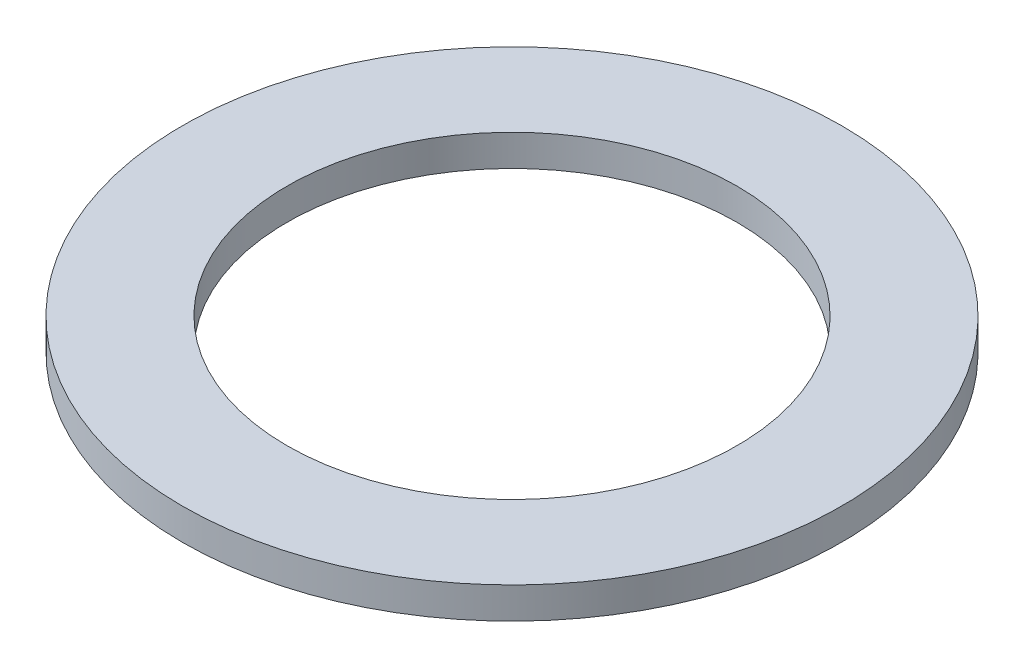
from build123d import *

# Parameters (mm, degrees)
SKETCH1_R           = 31.5
SKETCH1_R_2         = 21.5
BOSS_EXTRUDE1_DEPTH = 3


with BuildPart() as part:
    # Sketch1 → Boss-Extrude1 (new body)
    with BuildSketch(Plane(origin=(0, 0, 0), x_dir=(1, 0, 0), z_dir=(0, 1, 0))):
        with Locations(Location((0, 0, 0), (0, 0, 270))):
            Circle(SKETCH1_R)
        with Locations(Location((0, 0, 0), (0, 0, 270))):
            Circle(SKETCH1_R_2, mode=Mode.SUBTRACT)
    extrude(amount=BOSS_EXTRUDE1_DEPTH)


solid = part.part
